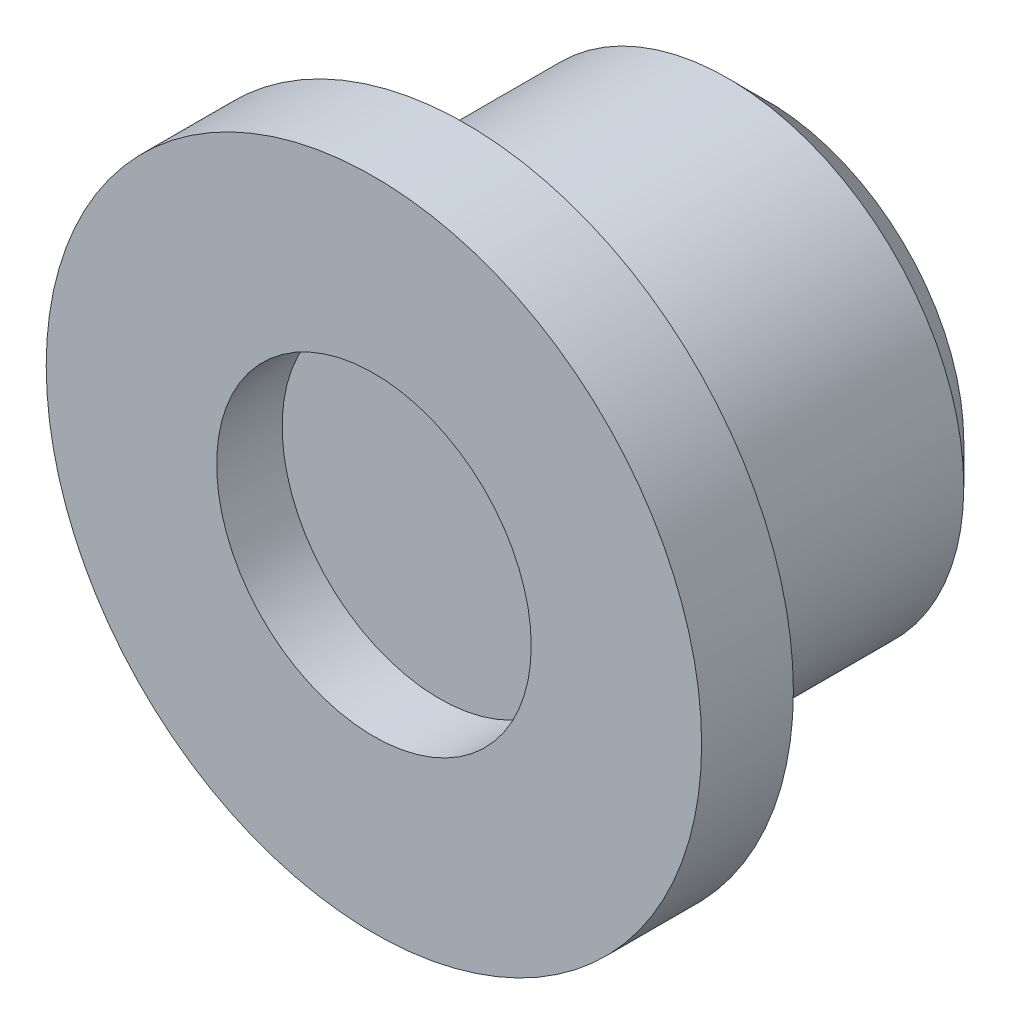
from build123d import *

# Parameters (mm, degrees)
SKETCH_1_R          = 1.8
EXTRUDE_1_DEPTH     = 3
EXTRUDE_START       = -0.7
SKETCH_2_R          = 2.5
SKETCH_2_R_2        = 1.8
EXTRUDE_2_DEPTH     = 0.7
SKETCH_3_R          = 1.2
CUT_EXTRUDE_1_DEPTH = 0.5
CHAMFER_1_SIZE      = 0.3


with BuildPart() as part:
    # 草图1 → 凸台-拉伸1 (new body)
    with BuildSketch(Plane.XY):
        Circle(SKETCH_1_R)
    extrude(amount=EXTRUDE_1_DEPTH)

    # 草图2 → 凸台-拉伸2 (add)
    with BuildSketch(Plane.XY.offset(3).offset(EXTRUDE_START)):
        Circle(SKETCH_2_R)
        Circle(SKETCH_2_R_2, mode=Mode.SUBTRACT)
    extrude(amount=EXTRUDE_2_DEPTH)

    # 草图3 → 切除-拉伸1 (cut)
    with BuildSketch(Plane.XY.offset(3)):
        Circle(SKETCH_3_R)
    extrude(amount=-CUT_EXTRUDE_1_DEPTH, mode=Mode.SUBTRACT)

    # 倒角1
    chamfer_1_edges = [part.edges().sort_by_distance(p)[0] for p in [
        (-1.8, 0, 0),
    ]]
    chamfer(chamfer_1_edges, length=CHAMFER_1_SIZE)


solid = part.part
